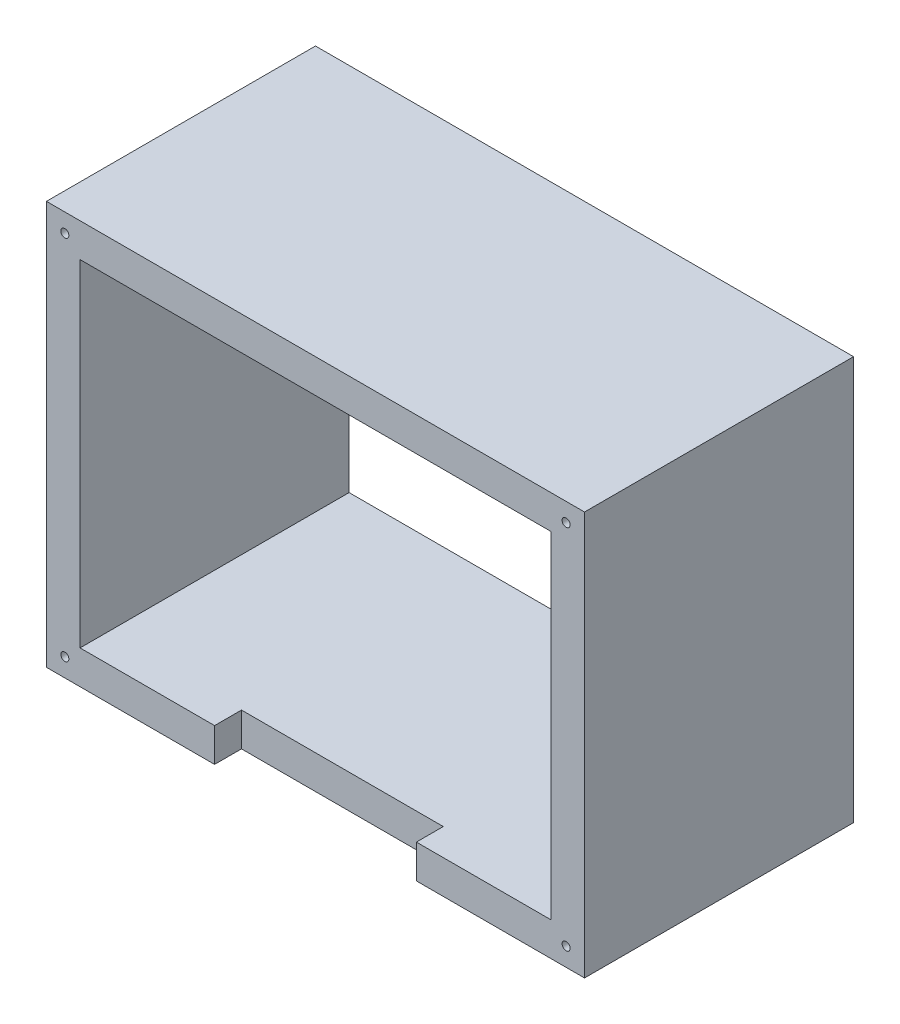
from build123d import *

# Parameters (mm, degrees)
SKETCH1_W           = 200
SKETCH1_H           = 150
BOSS_EXTRUDE1_DEPTH = 100
SKETCH2_W           = 175
SKETCH2_H           = 125
CUT_EXTRUDE1_DEPTH  = 100
SKETCH3_W           = 75
SKETCH3_H           = 10
CUT_EXTRUDE2_DEPTH  = 15
SKETCH4_R           = 1.5
CUT_EXTRUDE3_DEPTH  = 20


with BuildPart() as part:
    # Sketch1 → Boss-Extrude1 (new body)
    with BuildSketch(Plane.XY):
        with Locations((11.165128543, -17.619294273)):
            Rectangle(SKETCH1_W, SKETCH1_H)
    extrude(amount=BOSS_EXTRUDE1_DEPTH)

    # Sketch2 → Cut-Extrude1 (cut)
    with BuildSketch(Plane(origin=(0, 0, 0), x_dir=(-1, 0, 0), z_dir=(0, 0, -1))):
        with Locations((-11.165128543, -17.619294273)):
            Rectangle(SKETCH2_W, SKETCH2_H)
    extrude(amount=-CUT_EXTRUDE1_DEPTH, mode=Mode.SUBTRACT)

    # Sketch3 → Cut-Extrude2 (cut)
    with BuildSketch(Plane(origin=(0, -80.119294273, 0), x_dir=(1, 0, 0), z_dir=(0, 1, 0))):
        with Locations((11.165128543, -95)):
            Rectangle(SKETCH3_W, SKETCH3_H)
    extrude(amount=-CUT_EXTRUDE2_DEPTH, mode=Mode.SUBTRACT)

    # Sketch4 → Cut-Extrude3 (cut)
    with BuildSketch(Plane.XY.offset(100)):
        with Locations((-81.991725706, 50.537559977)):
            Circle(SKETCH4_R)
        with Locations((-81.991725706, -85.776148522)):
            Circle(SKETCH4_R)
        with Locations((104.321982793, 50.537559977)):
            Circle(SKETCH4_R)
        with Locations((104.321982793, -85.776148522)):
            Circle(SKETCH4_R)
    extrude(amount=-CUT_EXTRUDE3_DEPTH, mode=Mode.SUBTRACT)


solid = part.part
